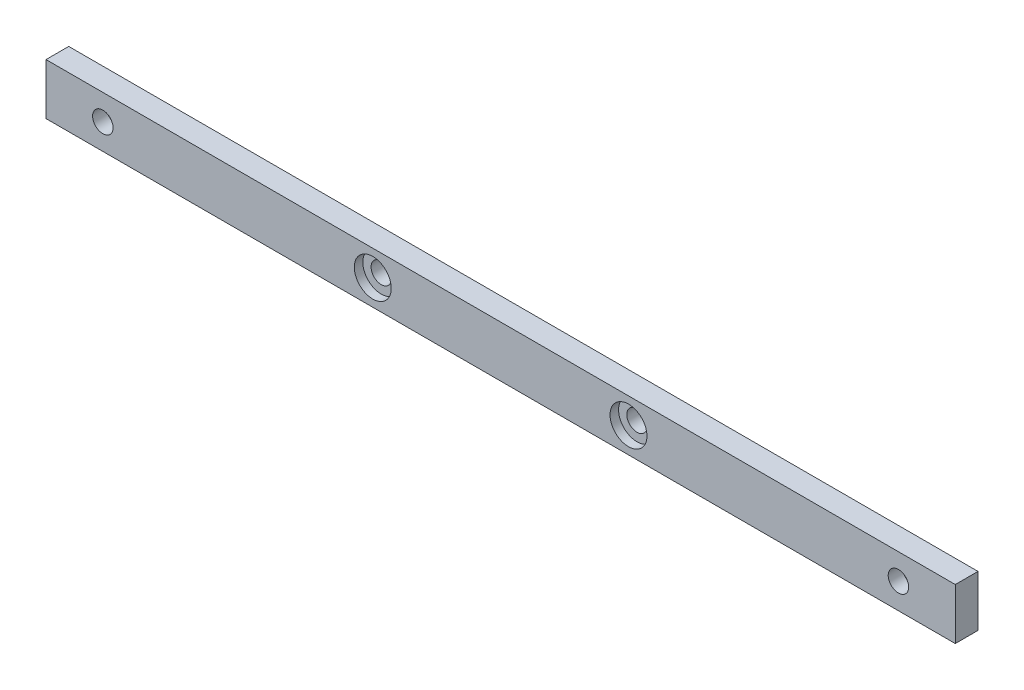
from build123d import *

# Parameters (mm, degrees)
SKETCH_1_W          = 60
SKETCH_1_H          = 10
SKETCH_1_R          = 1.8
EXTRUDE_1_DEPTH     = 4
SKETCH_2_R          = 3
CUT_EXTRUDE_1_DEPTH = 2
SKETCH_6_W          = 160
SKETCH_6_H          = 9
EXTRUDE_3_DEPTH     = 4
SKETCH_7_R          = 1.8
CUT_EXTRUDE_4_DEPTH = 4
SKETCH_8_R          = 3.25
CUT_EXTRUDE_5_DEPTH = 1.5
CUT_EXTRUDE_6_REACH = 113.7
SKETCH_9_R          = 1.8
CUT_EXTRUDE_7_REACH = 113.7
SKETCH_10_W         = 60
SKETCH_10_H         = 10
SKETCH_11_R         = 3.25
CUT_EXTRUDE_8_DEPTH = 1.5


with BuildPart() as part:
    # 草图1 → 凸台-拉伸1 (new body)
    with BuildSketch(Plane.XY):
        with Locations((30, 5)):
            Rectangle(SKETCH_1_W, SKETCH_1_H)
        with Locations((7.5, 5)):
            Circle(SKETCH_1_R, mode=Mode.SUBTRACT)
        with Locations((52.5, 5)):
            Circle(SKETCH_1_R, mode=Mode.SUBTRACT)
    extrude(amount=EXTRUDE_1_DEPTH)

    # 草图2 → 切除-拉伸1 (cut)
    with BuildSketch(Plane.XY.offset(4)):
        with Locations((7.5, 5)):
            Circle(SKETCH_2_R)
        with Locations((52.5, 5)):
            Circle(SKETCH_2_R)
    extrude(amount=-CUT_EXTRUDE_1_DEPTH, mode=Mode.SUBTRACT)

    # 草图6 → 凸台-拉伸3 (add)
    with BuildSketch(Plane.XY.offset(4)):
        with Locations((30, 14.5)):
            Rectangle(SKETCH_6_W, SKETCH_6_H)
    extrude(amount=-EXTRUDE_3_DEPTH)

    # 草图7 → 切除-拉伸4 (cut)
    with BuildSketch(Plane.XY.offset(4)):
        with Locations((-40, 14.5)):
            Circle(SKETCH_7_R)
        with Locations((100, 14.5)):
            Circle(SKETCH_7_R)
    extrude(amount=-CUT_EXTRUDE_4_DEPTH, mode=Mode.SUBTRACT)

    # 草图8 → 切除-拉伸5 (cut)
    with BuildSketch(Plane(origin=(0, 0, 0), x_dir=(-1, 0, 0), z_dir=(0, 0, -1))):
        with Locations((-100, 14.5)):
            Circle(SKETCH_8_R)
        with Locations((40, 14.5)):
            Circle(SKETCH_8_R)
    extrude(amount=-CUT_EXTRUDE_5_DEPTH, mode=Mode.SUBTRACT)

    # 草图9 → 切除-拉伸6 (cut, up to next)
    with BuildSketch(Plane.XY.offset(4), mode=Mode.PRIVATE) as cut_extrude_6_sk1:
        with Locations((7.5, 14.5)):
            Circle(SKETCH_9_R)
    cut_extrude_6_tool1 = extrude(cut_extrude_6_sk1.sketch, amount=-CUT_EXTRUDE_6_REACH, mode=Mode.PRIVATE) & part.part
    # 草图9 → 切除-拉伸6 (cut, up to next)
    with BuildSketch(Plane.XY.offset(4), mode=Mode.PRIVATE) as cut_extrude_6_sk2:
        with Locations((52.5, 14.5)):
            Circle(SKETCH_9_R)
    cut_extrude_6_tool2 = extrude(cut_extrude_6_sk2.sketch, amount=-CUT_EXTRUDE_6_REACH, mode=Mode.PRIVATE) & part.part
    add(cut_extrude_6_tool1.solids().sort_by_distance((7.5, 14.5, 4))[0], mode=Mode.SUBTRACT)
    add(cut_extrude_6_tool2.solids().sort_by_distance((52.5, 14.5, 4))[0], mode=Mode.SUBTRACT)

    # 草图10 → 切除-拉伸7 (cut, up to next)
    with BuildSketch(Plane.XY.offset(4), mode=Mode.PRIVATE) as cut_extrude_7_sk1:
        with Locations((30, 5)):
            Rectangle(SKETCH_10_W, SKETCH_10_H)
    cut_extrude_7_tool1 = extrude(cut_extrude_7_sk1.sketch, amount=-CUT_EXTRUDE_7_REACH, mode=Mode.PRIVATE) & part.part
    add(cut_extrude_7_tool1.solids().sort_by_distance((30, 5, 4))[0], mode=Mode.SUBTRACT)

    # 草图11 → 切除-拉伸8 (cut)
    with BuildSketch(Plane.XY.offset(4)):
        with Locations((7.5, 14.5)):
            Circle(SKETCH_11_R)
        with Locations((52.5, 14.5)):
            Circle(SKETCH_11_R)
    extrude(amount=-CUT_EXTRUDE_8_DEPTH, mode=Mode.SUBTRACT)


solid = part.part
